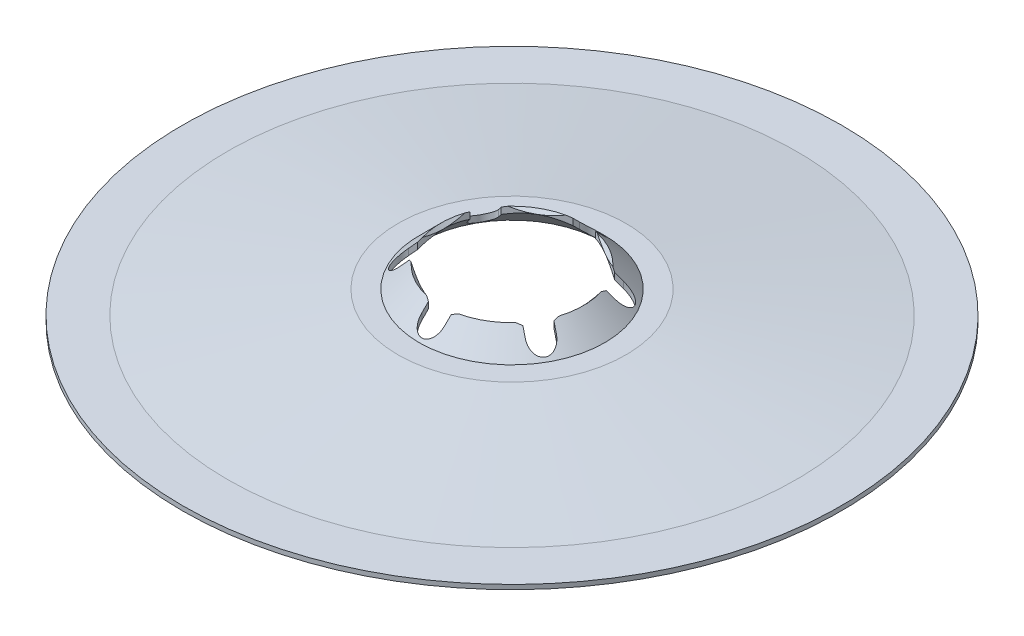
from build123d import *

# Parameters (mm, degrees)
CUT_EXTRUDE2_DEPTH = 10


with BuildPart() as part:
    # Sketch1 → Revolve1 (revolve)
    with BuildSketch(Plane(origin=(0, 0, 0), x_dir=(0, 0, -1), z_dir=(1, 0, 0))):
        Polygon((0, 0), (0, 0.2), (1.986725405, 0.2), (9.486725405, 1.2), (10.417157288, 1.2), (11.358578644, 2.141421356), (11.5, 2), (10.5, 1), (9.5, 1), (2, 0), align=None)
    revolve(axis=Axis((0, 1.2, -14.5), (0, -1, 0)))

    # Sketch3 → Cut-Extrude2 (cut)
    with BuildSketch(Plane(origin=(0, 0, 0), x_dir=(1, 0, 0), z_dir=(0, 1, 0))):
        with BuildLine():
            Line((3.25, 13.200961894), (3, 13.345299462))
            Line((3, 13.345299462), (3, 15.654700538))
            Line((3, 15.654700538), (3.25, 15.799038106))
            ThreePointArc((3.25, 15.799038106), (3.433012702, 16.482050808), (2.75, 16.665063509))
            Line((2.75, 16.665063509), (2.5, 16.520725942))
            Line((2.5, 16.520725942), (0.5, 17.675426481))
            Line((0.5, 17.675426481), (0.5, 17.964101615))
            ThreePointArc((0.5, 17.964101615), (0, 18.464101615), (-0.5, 17.964101615))
            Line((-0.5, 17.964101615), (-0.5, 17.675426481))
            Line((-0.5, 17.675426481), (-2.5, 16.520725942))
            Line((-2.5, 16.520725942), (-2.75, 16.665063509))
            ThreePointArc((-2.75, 16.665063509), (-3.433012702, 16.482050808), (-3.25, 15.799038106))
            Line((-3.25, 15.799038106), (-3, 15.654700538))
            Line((-3, 15.654700538), (-3, 13.345299462))
            Line((-3, 13.345299462), (-3.25, 13.200961894))
            ThreePointArc((-3.25, 13.200961894), (-3.433012702, 12.517949192), (-2.75, 12.334936491))
            Line((-2.75, 12.334936491), (-2.5, 12.479274058))
            Line((-2.5, 12.479274058), (-0.5, 11.324573519))
            Line((-0.5, 11.324573519), (-0.5, 11.035898385))
            ThreePointArc((-0.5, 11.035898385), (0, 10.535898385), (0.5, 11.035898385))
            Line((0.5, 11.035898385), (0.5, 11.324573519))
            Line((0.5, 11.324573519), (2.5, 12.479274058))
            Line((2.5, 12.479274058), (2.75, 12.334936491))
            ThreePointArc((2.75, 12.334936491), (3.433012702, 12.517949192), (3.25, 13.200961894))
        make_face()
    extrude(amount=CUT_EXTRUDE2_DEPTH, mode=Mode.SUBTRACT)


solid = part.part
